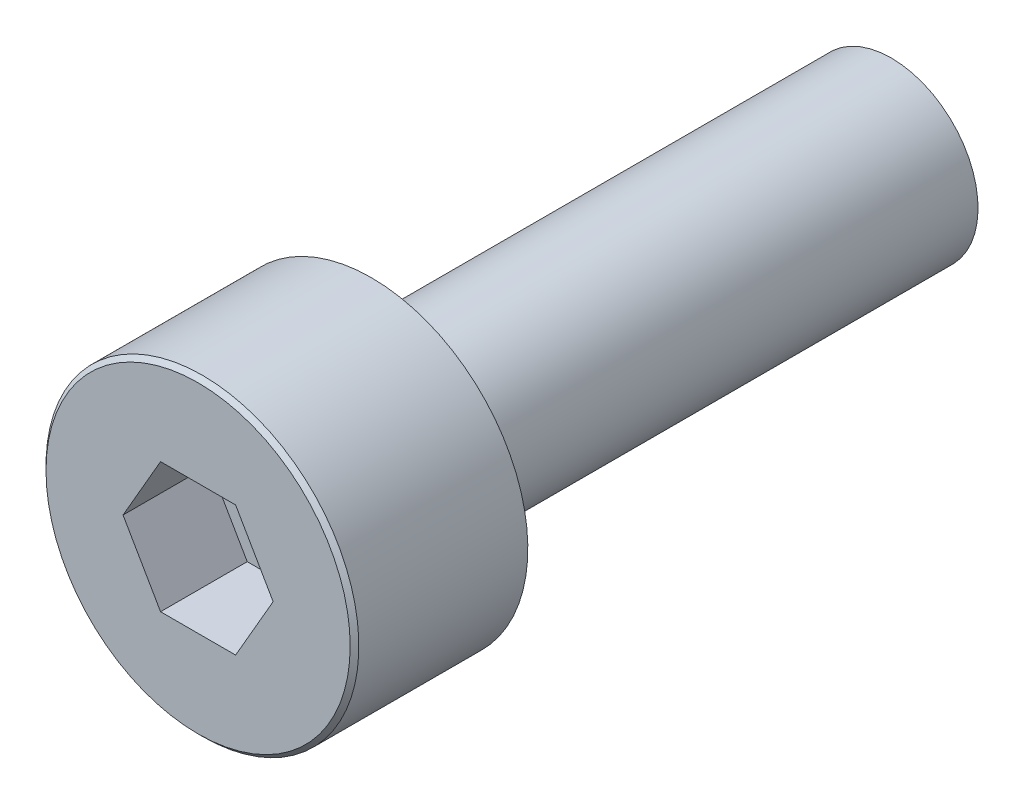
from build123d import *

# Parameters (mm, degrees)
CUT_EXTRUDE_1_DEPTH = 2
CHAMFER_620_SIZE    = 0.1


with BuildPart() as part:
    # 草图1 → 旋转1 (revolve)
    with BuildSketch(Plane(origin=(0, 0, 0), x_dir=(0, 0, -1), z_dir=(1, 0, 0))):
        Polygon((0, 0), (0, 3.61), (4, 3.61), (4, 2), (16, 2), (16, 0), align=None)
    revolve(axis=Axis((0, 0, -16), (0, 0, 1)))

    # 草图2 → 切除-拉伸1 (cut)
    with BuildSketch(Plane.XY):
        Polygon((0.866025404, 1.5), (-0.866025404, 1.5), (-1.732050808, 0), (-0.866025404, -1.5), (0.866025404, -1.5), (1.732050808, 0), align=None)
    extrude(amount=-CUT_EXTRUDE_1_DEPTH, mode=Mode.SUBTRACT)

    # Chamfer 620
    chamfer_620_edges = [part.edges().sort_by_distance(p)[0] for p in [
        (0, -3.61, 0),
    ]]
    chamfer(chamfer_620_edges, length=CHAMFER_620_SIZE)


solid = part.part
